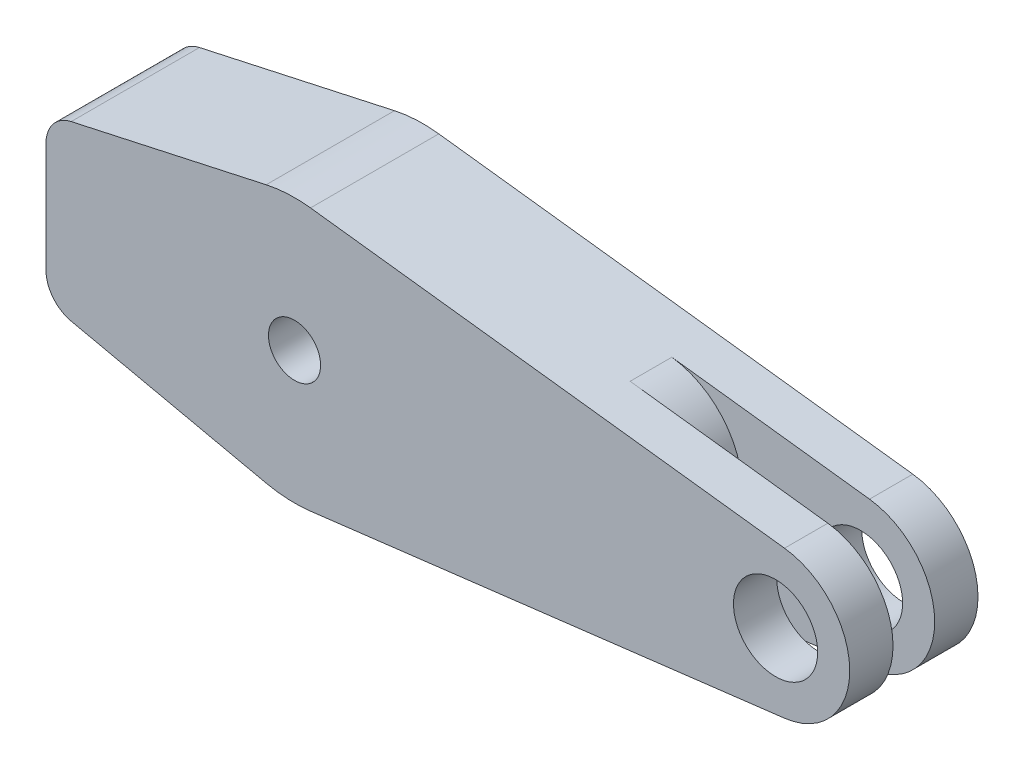
from build123d import *

# Parameters (mm, degrees)
SKETCH2_R               = 2.625
BOSS_EXTRUDE2_DEPTH     = 8
CUT_EXTRUDE5_DEPTH      = 3.15
CUT_EXTRUDE6_DEPTH      = 37.482230264
CUT_EXTRUDE6_DEPTH_BACK = 37.482230264
SKETCH6_W               = 24
SKETCH6_H               = 2.6
FILLET1_R               = 5
CUT_EXTRUDE7_DEPTH      = 37.482230264
CUT_EXTRUDE7_DEPTH_BACK = 37.482230264
SKETCH1_7_R             = 1.625
SKETCH7_W               = 26.970959806
SKETCH7_H               = 23.004642188
CUT_EXTRUDE8_DEPTH      = 37.482230264
FILLET2_R               = 2


with BuildPart() as part:
    # Sketch2 → Boss-Extrude2 (new body)
    with BuildSketch(Plane.XY):
        with BuildLine():
            ThreePointArc((-18.464285714, 4.395469606), (-22, 0), (-18.464285714, -4.395469606))
            Line((-18.464285714, -4.395469606), (-1.767857143, -8.058360945))
            ThreePointArc((-1.767857143, -8.058360945), (-0.391032035, -8.240727756), (0.996875, -8.189550674))
            Line((0.996875, -8.189550674), (30.558854167, -4.591111741))
            ThreePointArc((30.558854167, -4.591111741), (34.625, 0), (30.558854167, 4.591111741))
            Line((30.558854167, 4.591111741), (0.996875, 8.189550674))
            ThreePointArc((0.996875, 8.189550674), (-0.391032035, 8.240727756), (-1.767857143, 8.058360945))
            Line((-1.767857143, 8.058360945), (-18.464285714, 4.395469606))
        make_face()
        with Locations((30, 0)):
            Circle(SKETCH2_R, mode=Mode.SUBTRACT)
    extrude(amount=BOSS_EXTRUDE2_DEPTH)

    # Sketch1 → Cut-Extrude5 (cut)
    with BuildSketch(Plane.XY):
        with BuildLine():
            Line((-1.339285714, 6.104818898), (-18.035714286, 2.441927559))
            ThreePointArc((-18.035714286, 2.441927559), (-20, 0), (-18.035714286, -2.441927559))
            Line((-18.035714286, -2.441927559), (-1.339285714, -6.104818898))
            ThreePointArc((-1.339285714, -6.104818898), (0, -6.25), (1.339285714, -6.104818898))
            Line((1.339285714, -6.104818898), (18.035714286, -2.441927559))
            ThreePointArc((18.035714286, -2.441927559), (20, 0), (18.035714286, 2.441927559))
            Line((18.035714286, 2.441927559), (1.339285714, 6.104818898))
            ThreePointArc((1.339285714, 6.104818898), (0, 6.25), (-1.339285714, 6.104818898))
        make_face()
    extrude(amount=CUT_EXTRUDE5_DEPTH, mode=Mode.SUBTRACT)

    # Sketch6 → Cut-Extrude6 (cut, two sides: drawn at the far end of the back side and taken through both)
    with BuildSketch(Plane(origin=(0, 0, 0), x_dir=(1, 0, 0), z_dir=(0, 1, 0)).offset(-CUT_EXTRUDE6_DEPTH_BACK)):
        with Locations((34.625, -4)):
            Rectangle(SKETCH6_W, SKETCH6_H)
    extrude(amount=CUT_EXTRUDE6_DEPTH + CUT_EXTRUDE6_DEPTH_BACK, mode=Mode.SUBTRACT)

    # Fillet1
    fillet1_edges = [part.edges().sort_by_distance(p)[0] for p in [
        (22.625, -5.556862023, 4),
        (22.625, 5.556862023, 4),
    ]]
    fillet(fillet1_edges, radius=FILLET1_R)

    # Sketch1<7> → Cut-Extrude7 (cut, two sides: drawn at the far end of the back side and taken through both)
    with BuildSketch(Plane.XY.offset(-CUT_EXTRUDE7_DEPTH_BACK)):
        Circle(SKETCH1_7_R)
    extrude(amount=CUT_EXTRUDE7_DEPTH + CUT_EXTRUDE7_DEPTH_BACK, mode=Mode.SUBTRACT)

    # Sketch7 → Cut-Extrude8 (cut, through all)
    with BuildSketch(Plane.XY):
        with Locations((-28.985479903, 0)):
            Rectangle(SKETCH7_W, SKETCH7_H)
    extrude(amount=CUT_EXTRUDE8_DEPTH, mode=Mode.SUBTRACT)

    # Fillet2
    fillet2_edges = [part.edges().sort_by_distance(p)[0] for p in [
        (-15.5, 5.045779726, 4),
        (-15.5, -5.045779726, 4),
    ]]
    fillet(fillet2_edges, radius=FILLET2_R)


solid = part.part
